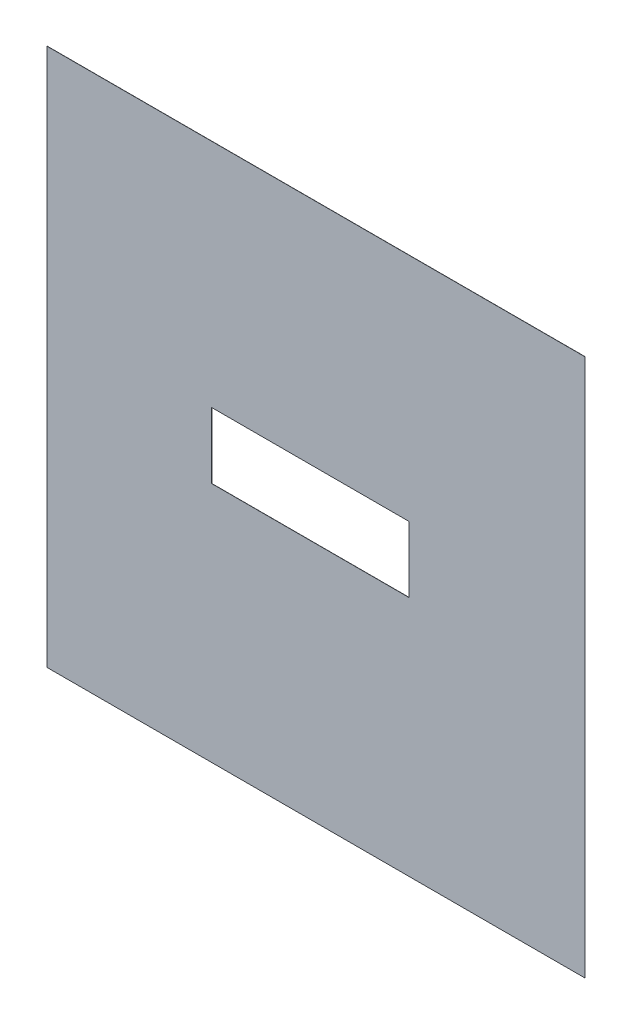
from build123d import *

# Parameters (mm, degrees)
SKETCH1_W           = 98
SKETCH1_H           = 98
BOSS_EXTRUDE1_DEPTH = 0.035
SKETCH2_W           = 36
SKETCH2_H           = 12
CUT_EXTRUDE1_DEPTH  = 10


with BuildPart() as part:
    # Sketch1 → Boss-Extrude1 (new body)
    with BuildSketch(Plane.XY):
        with Locations((49, -49)):
            Rectangle(SKETCH1_W, SKETCH1_H)
    extrude(amount=BOSS_EXTRUDE1_DEPTH)

    # Sketch2 → Cut-Extrude1 (cut)
    with BuildSketch(Plane(origin=(0, 0, 0), x_dir=(-1, 0, 0), z_dir=(0, 0, -1))):
        with Locations((-48, -48)):
            Rectangle(SKETCH2_W, SKETCH2_H)
    extrude(amount=-CUT_EXTRUDE1_DEPTH, mode=Mode.SUBTRACT)


solid = part.part
